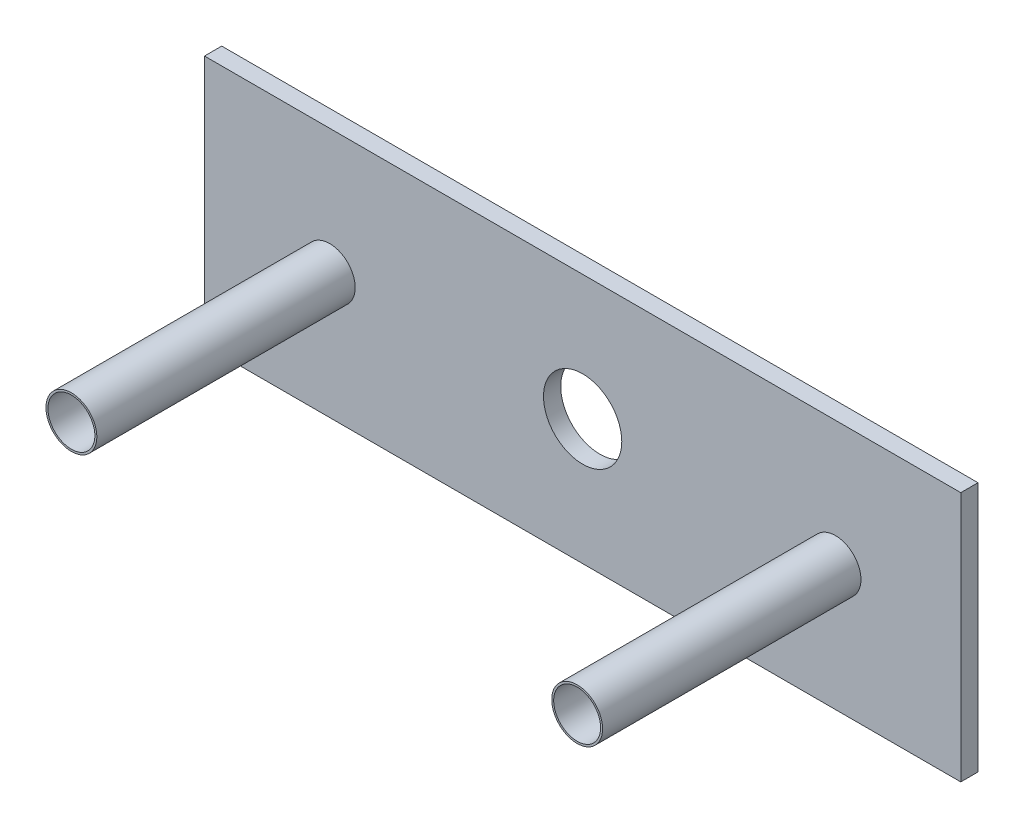
from build123d import *

# Parameters (mm, degrees)
ESQUISSE1_W             = 96.6
ESQUISSE1_H             = 32
BOSS_EXTRU_1_DEPTH      = 2.2
ESQUISSE6_R             = 3.25
BOSS_EXTRU_2_DEPTH      = 33
ESQUISSE7_R             = 3
ESQUISSE7_R_2           = 5
ENL_V_MAT_EXTRU_1_DEPTH = 64.013010851


with BuildPart() as part:
    # Esquisse1 → Boss.-Extru.1 (new body)
    with BuildSketch(Plane.XY):
        with Locations((0.671156739, 2.259938231)):
            Rectangle(ESQUISSE1_W, ESQUISSE1_H)
    extrude(amount=BOSS_EXTRU_1_DEPTH)

    # Esquisse6 → Boss.-Extru.2 (add)
    with BuildSketch(Plane.XY.offset(2.2)):
        with Locations((-31.628843261, 2.259938231)):
            Circle(ESQUISSE6_R)
        with Locations((32.971156739, 2.259938231)):
            Circle(ESQUISSE6_R)
    extrude(amount=BOSS_EXTRU_2_DEPTH)

    # Esquisse7 → Enlèv. mat.-Extru.1 (cut, through all)
    with BuildSketch(Plane.XY.offset(35.2)):
        with Locations((-31.628843261, 2.259938231)):
            Circle(ESQUISSE7_R)
        with Locations((32.971156739, 2.259938231)):
            Circle(ESQUISSE7_R)
        with Locations((0.671156739, 2.259938231)):
            Circle(ESQUISSE7_R_2)
    extrude(amount=-ENL_V_MAT_EXTRU_1_DEPTH, mode=Mode.SUBTRACT)


solid = part.part
